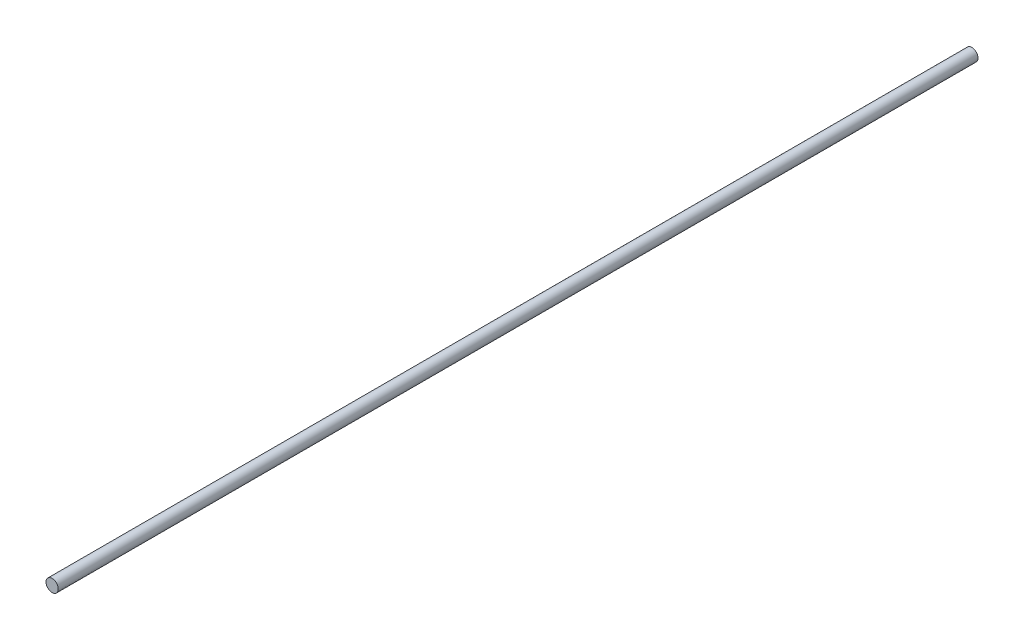
from build123d import *

# Parameters (mm, degrees)
SZKIC1_R                    = 1.5
DODANIE_WYCI_GNI_CIE1_DEPTH = 225


with BuildPart() as part:
    # Szkic1 → Dodanie-wyciągnięcie1 (new body)
    with BuildSketch(Plane.XY):
        Circle(SZKIC1_R)
    extrude(amount=DODANIE_WYCI_GNI_CIE1_DEPTH)


solid = part.part
